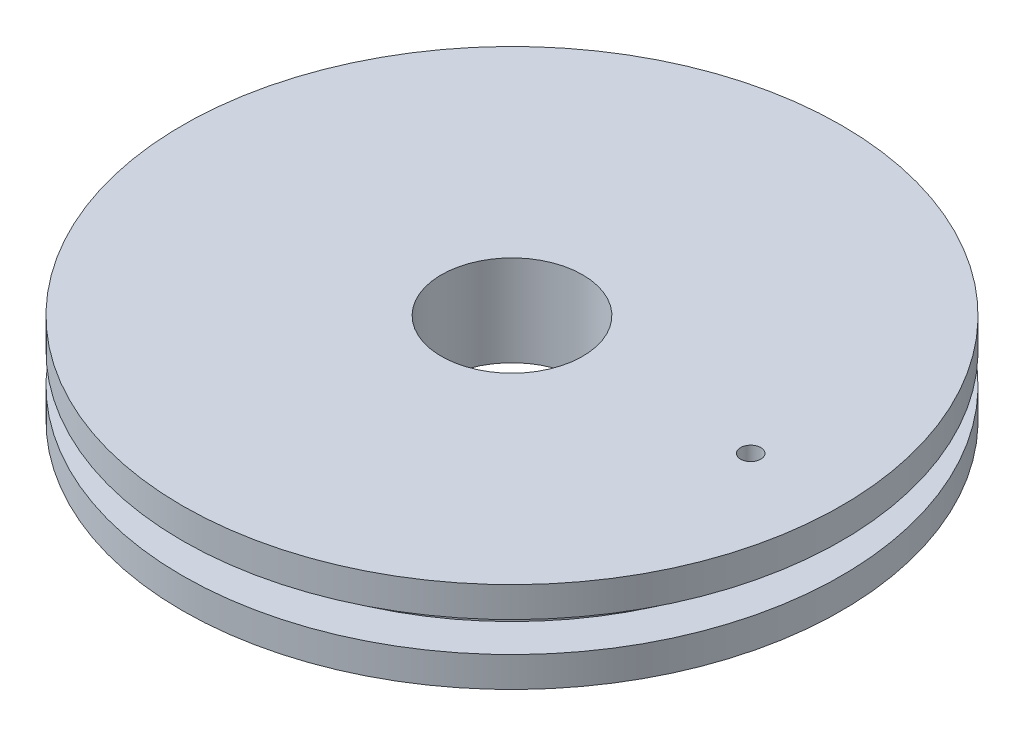
from build123d import *

# Parameters (mm, degrees)
SKETCH2_R          = 1
CUT_EXTRUDE1_DEPTH = 48.043012233


with BuildPart() as part:
    # Sketch1 → Revolve1 (revolve)
    with BuildSketch(Plane.XY, mode=Mode.PRIVATE) as revolve1_sk:
        Polygon((7, 4.5), (32.65, 4.5), (32.65, 1.5), (28.65, 1.5), (28.65, -1.5), (32.65, -1.5), (32.65, -4.5), (7, -4.5), align=None)
    revolve(revolve1_sk.sketch.rotate(Axis((0, 0, 0), (0, 1, 0)), 90), axis=Axis((0, 0, 0), (0, 1, 0)))

    # Sketch2 → Cut-Extrude1 (cut, through all)
    with BuildSketch(Plane(origin=(0, 4.5, 0), x_dir=(1, 0, 0), z_dir=(0, 1, 0))):
        with Locations(Location((23.65, 0, 0), (0, 0, 270))):
            Circle(SKETCH2_R)
    extrude(amount=-CUT_EXTRUDE1_DEPTH, mode=Mode.SUBTRACT)


solid = part.part
